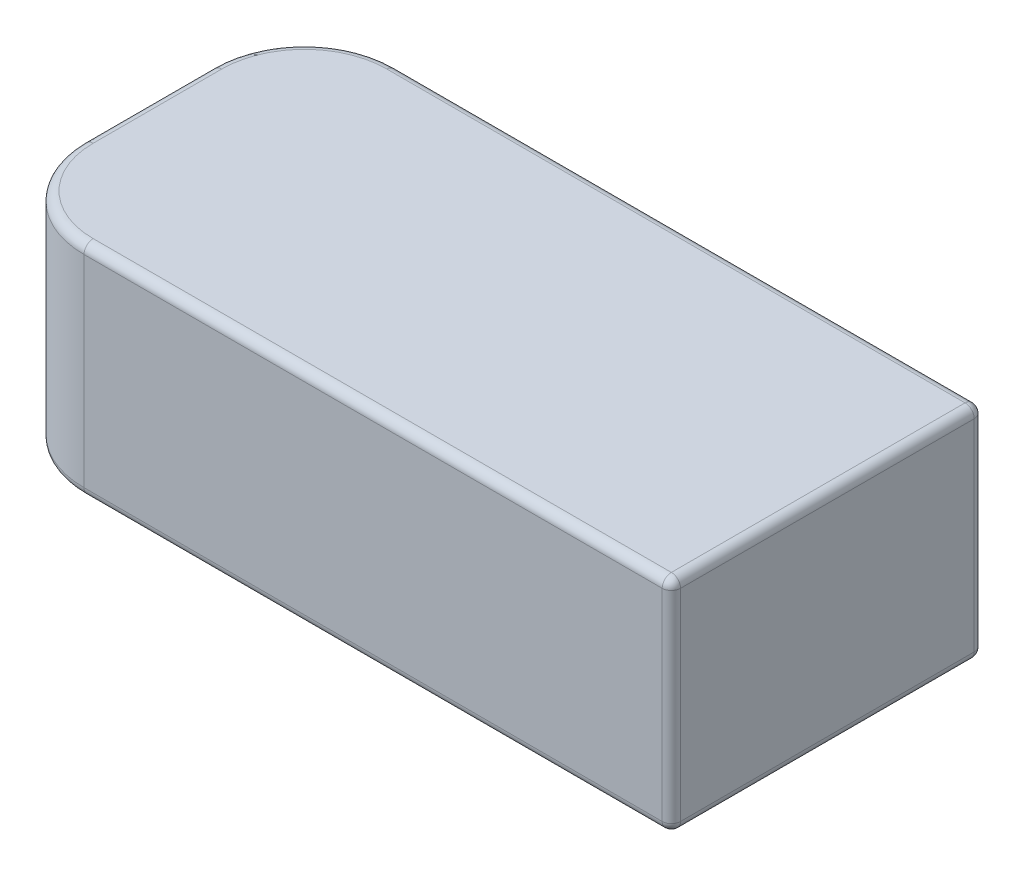
from build123d import *

# Parameters (mm, degrees)
SKETCH1_W           = 74
SKETCH1_H           = 34
BOSS_EXTRUDE1_DEPTH = 24
FILLET1_R           = 10
FILLET2_R           = 1


with BuildPart() as part:
    # Sketch1 → Boss-Extrude1 (new body)
    with BuildSketch(Plane(origin=(0, 0, 0), x_dir=(1, 0, 0), z_dir=(0, 1, 0))):
        Rectangle(SKETCH1_W, SKETCH1_H)
    extrude(amount=BOSS_EXTRUDE1_DEPTH)

    # Fillet1
    fillet1_edges = [part.edges().sort_by_distance(p)[0] for p in [
        (-37, 12, 17),
        (-37, 12, -17),
    ]]
    fillet(fillet1_edges, radius=FILLET1_R)

    # Fillet2
    fillet2_edges = [part.edges().sort_by_distance(p)[0] for p in [
        (-37, 0, 0),
        (-37, 24, 0),
        (5, 0, 17),
        (-34.071067812, 0, 14.071067812),
        (-34.071067812, 0, -14.071067812),
        (5, 24, 17),
        (-34.071067812, 24, 14.071067812),
        (-34.071067812, 24, -14.071067812),
        (37, 24, 0),
        (5, 0, -17),
        (37, 0, 0),
        (37, 12, 17),
        (37, 12, -17),
        (5, 24, -17),
    ]]
    fillet(fillet2_edges, radius=FILLET2_R)


solid = part.part
